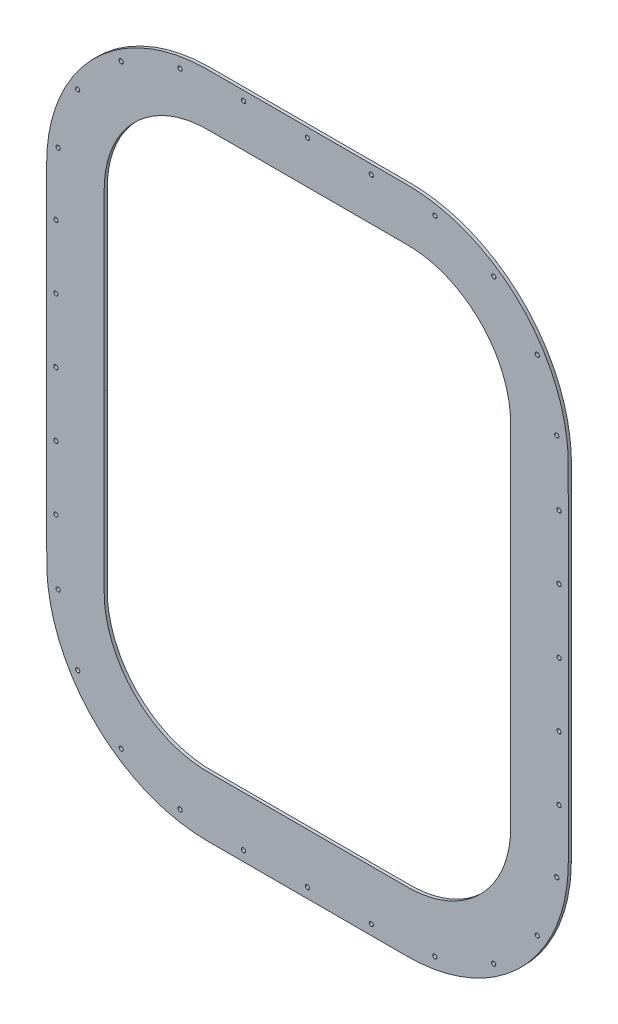
from build123d import *

# Parameters (mm, degrees)
EXTRUDE_1_DEPTH = 4


with BuildPart() as part:
    # Model → Бобышка-Вытянуть1 (new body)
    with BuildSketch(Plane.XY):
        with BuildLine():
            add(Edge.make_bspline(
                [(686.79903265, 219.435095571), (686.801471574, 233.710822805), (686.799796508, 247.986549765), (686.799693819, 276.538003981), (686.800054944, 290.813731085), (686.800062362, 333.640912407), (686.79998244, 362.192366622), (686.799968233, 447.846729266), (686.800032272, 504.949637696), (686.799998033, 590.619212881), (686.799984126, 619.185879641), (686.800004155, 654.894213078), (686.803094929, 662.03590296), (686.798415235, 670.962957183), (686.777172726, 672.748258396), (686.685899664, 676.317944766), (686.617565487, 678.101551055), (686.344461131, 683.450814472), (686.072136738, 687.00677774), (684.256643142, 704.768575572), (681.362249708, 718.793821863), (672.786503269, 746.043387423), (667.12629412, 759.199874441), (653.241191579, 784.166729827), (645.050169816, 795.916181646), (626.424351628, 817.579742508), (616.051023033, 827.425111673), (593.440710518, 844.892660865), (581.272176642, 852.454767545), (555.563225467, 865.000542833), (542.066845447, 869.951118157), (514.3075967, 877.00391814), (500.089153855, 879.096160255), (483.993146605, 879.789498154), (482.146292014, 879.843981489), (478.691016285, 879.904715907), (477.632260397, 879.905743494), (472.804663661, 879.905123625), (468.903336119, 879.905483704), (458.163406683, 879.905514761), (451.003453726, 879.905520494), (429.523594855, 879.905518157), (415.20368894, 879.905499555), (343.604159369, 879.905483646), (286.324535712, 879.905747584), (225.47219111, 879.905283517), (221.89946981, 879.905153046), (217.433569075, 879.905234528), (216.540398183, 879.908122082), (214.754026754, 879.896723484), (213.860933019, 879.886817803), (211.181750852, 879.837588571), (209.396765235, 879.781834933), (200.473365208, 879.388318468), (193.362393768, 878.70749377), (172.156128166, 875.572295263), (158.290723249, 872.041115037), (131.458468929, 862.195415115), (118.600361788, 855.921296787), (94.322258209, 840.841347264), (82.97329922, 832.074248392), (62.244802154, 812.400835304), (52.9194129, 801.552840549), (36.577247232, 778.110035589), (29.624529656, 765.609070045), (18.331446385, 739.359778286), (14.03388118, 725.707906682), (8.259345446, 697.722605973), (6.798204201, 683.447731688), (6.800000054, 669.159812492)],
                knots=[1370.97340501, 1370.97340501, 1370.97340501, 1370.97340501, 1413.74012173, 1413.74012173, 1456.50683845, 1456.50683845, 1542.04027189, 1542.04027189, 1713.10713877, 1713.10713877, 1798.686145398, 1798.686145398, 1820.080897055, 1820.080897055, 1825.429584969, 1825.429584969, 1830.778272883, 1830.778272883, 1841.475648712, 1841.475648712, 1884.265152026, 1884.265152026, 1927.054655339, 1927.054655339, 1969.844158653, 1969.844158653, 2012.633661967, 2012.633661967, 2055.423165281, 2055.423165281, 2098.311407557, 2098.311407557, 2141.199649833, 2141.199649833, 2146.560680117, 2146.560680117, 2151.921710402, 2151.921710402, 2162.643770971, 2162.643770971, 2184.087892109, 2184.087892109, 2226.976134385, 2226.976134385, 2398.529103488, 2398.529103488, 2409.229433669, 2409.229433669, 2411.904516214, 2411.904516214, 2414.579598759, 2414.579598759, 2419.92976385, 2419.92976385, 2441.330424212, 2441.330424212, 2484.131744935, 2484.131744935, 2526.933065659, 2526.933065659, 2569.734386383, 2569.734386383, 2612.535707106, 2612.535707106, 2655.33702783, 2655.33702783, 2698.138348553, 2698.138348553, 2740.939669277, 2740.939669277, 2740.939669277, 2740.939669277], degree=3))
            add(Edge.make_bspline(
                [(6.800000054, 669.159812492), (6.800000052, 554.953992939), (6.800000064, 440.748173386), (6.800000065, 297.972014993), (6.800002007, 269.401676152), (6.799999815, 237.260044957), (6.799976961, 233.688752602), (6.799965846, 226.546167892), (6.798811526, 222.974727472), (6.802551566, 212.261299053), (7.161670273, 205.163999326), (9.335707046, 183.846146673), (12.233294719, 169.790189422), (20.808315362, 142.535856727), (26.469921657, 129.371468925), (36.886789771, 110.644641399), (40.651222618, 104.616208217), (48.821585477, 92.896367332), (53.176222082, 87.27963982), (67.147740829, 71.028967324), (77.523248196, 61.182367628), (100.139222525, 43.714897653), (112.320449161, 36.147734993), (138.040848463, 23.604414434), (151.543512394, 18.655164261), (172.372718421, 13.368309255), (179.362263869, 11.971402257), (193.53635422, 9.888100577), (200.631941496, 9.2149444), (209.57822955, 8.827831841), (211.423025702, 8.77291108), (214.8870471, 8.711495234), (215.904356708, 8.710739001), (220.630646515, 8.711876811), (224.587674201, 8.711222269), (235.332483269, 8.711159611), (242.495689315, 8.711133699), (263.985307451, 8.71108877), (278.311719542, 8.711102561), (349.943779995, 8.711193276), (407.249428358, 8.711068856), (468.137306279, 8.711191166), (471.738896962, 8.71126918), (477.083036636, 8.711178142), (478.213059417, 8.708891428), (481.441211907, 8.756565881), (483.365339667, 8.806326807), (492.313637777, 9.164819699), (499.415687529, 9.816461833), (513.593463849, 11.85502666), (520.593513288, 13.23087233), (534.48754909, 16.712896814), (541.309582069, 18.798975661), (561.507615986, 26.12504965), (574.438657871, 32.38114517), (598.826725282, 47.423771888), (610.220134107, 56.175523364), (631.053585366, 75.845469596), (640.444817944, 86.724454426), (656.870507841, 110.19852736), (663.880519551, 122.76357344), (675.223995329, 149.072040629), (679.547566955, 162.782857938), (683.892752152, 183.825114761), (684.977886456, 190.868098881), (686.071368565, 201.555237786), (686.344546564, 205.12148439), (686.61831603, 210.486107497), (686.686774203, 212.274800581), (686.77810648, 215.854731703), (686.798726751, 217.644583058), (686.79903265, 219.435095571)],
                knots=[0, 0, 0, 0, 342.110543955, 342.110543955, 427.694747981, 427.694747981, 438.392773485, 438.392773485, 449.090798988, 449.090798988, 470.486849995, 470.486849995, 513.278952008, 513.278952008, 556.071054021, 556.071054021, 577.467105027, 577.467105027, 598.863156034, 598.863156034, 641.655258047, 641.655258047, 684.44736006, 684.44736006, 727.351485227, 727.351485227, 748.80354781, 748.80354781, 770.255610394, 770.255610394, 775.618626039, 775.618626039, 780.981641685, 780.981641685, 791.707672977, 791.707672977, 813.15973556, 813.15973556, 856.063860727, 856.063860727, 1027.680361394, 1027.680361394, 1038.408269007, 1038.408269007, 1043.772222814, 1043.772222814, 1049.13617662, 1049.13617662, 1070.591991846, 1070.591991846, 1092.047807072, 1092.047807072, 1113.503622298, 1113.503622298, 1156.41525275, 1156.41525275, 1199.326883202, 1199.326883202, 1242.238513654, 1242.238513654, 1285.150144106, 1285.150144106, 1328.061774558, 1328.061774558, 1349.517589784, 1349.517589784, 1360.245497397, 1360.245497397, 1365.609451204, 1365.609451204, 1370.97340501, 1370.97340501, 1370.97340501, 1370.97340501], degree=3))
        make_face()
        with BuildLine():
            add(Edge.make_bspline(
                [(611.800005283, 449.694859246), (611.800005277, 402.179111379), (611.799999115, 354.663363511), (611.800001907, 283.38974171), (611.800000229, 259.631867776), (611.800000023, 232.904259601), (611.800170703, 229.934525303), (611.799903097, 225.479924029), (611.800509814, 223.971079763), (611.799883027, 221.05385288), (611.787373905, 219.81352136), (611.574885277, 212.400970284), (611.015480159, 206.482944612), (608.172904292, 188.891071297), (604.734918929, 177.444848433), (594.960556039, 155.786030333), (588.633075829, 145.60389916), (577.327304833, 131.827477596), (573.266651017, 127.495319203), (564.58286839, 119.384918455), (559.959598453, 115.605154374), (550.282723746, 108.709280776), (545.216747116, 105.580797567), (534.716879579, 100.018566201), (529.296989473, 97.59032075), (512.58420655, 91.393000455), (500.919338067, 88.741274009), (486.126720279, 87.389018693), (483.121573922, 87.216298793), (478.735998706, 87.10603426), (477.566252414, 87.098990269), (474.647171685, 87.101024236), (473.137581148, 87.100219803), (465.710546617, 87.100911096), (459.768918745, 87.100409378), (441.944035511, 87.100199734), (430.060780013, 87.10035315), (394.411013532, 87.100352269), (370.644502544, 87.10035105), (323.140531461, 87.100352502), (299.403071366, 87.100354939), (263.796881223, 87.100353391), (251.928151176, 87.100348049), (234.125056104, 87.100332859), (228.190691082, 87.100339217), (220.772734804, 87.100550627), (219.289142411, 87.100743241), (217.063757254, 87.100628119), (216.321976681, 87.098433568), (214.838385532, 87.113368553), (214.096709431, 87.125318415), (210.388753912, 87.220293292), (207.43272874, 87.393187453), (192.657975435, 88.748394351), (181.013950603, 91.392577045), (164.320990377, 97.583186901), (158.878844895, 100.019327381), (148.390177121, 105.575229251), (143.308796145, 108.713987718), (133.645206533, 115.604715677), (129.036518062, 119.371915583), (120.360904055, 127.469085942), (116.332994012, 131.756714139), (108.794979798, 140.923192373), (105.32494235, 145.758553619), (99.055100746, 155.834436654), (96.260427839, 161.065119677), (91.370290537, 171.878155055), (89.279102239, 177.452066816), (85.849515986, 188.813024816), (84.514594917, 194.591303452), (82.604364943, 206.30365302), (82.03758274, 212.206938125), (81.838370663, 218.879141746), (81.822364977, 219.620575312), (81.802178326, 221.103820459), (81.800047994, 221.845433327), (81.799947388, 224.070429724), (81.800011971, 225.553764294), (81.800009116, 230.003762564), (81.800007456, 232.970428077), (81.799994447, 259.670417693), (81.799996624, 283.403741796), (81.800000579, 354.603714105), (81.799999469, 402.070362312), (81.800000048, 449.537010518)],
                knots=[1139.240406798, 1139.240406798, 1139.240406798, 1139.240406798, 1281.689862325, 1281.689862325, 1352.914590088, 1352.914590088, 1361.817681058, 1361.817681058, 1366.269226543, 1366.269226543, 1370.720772029, 1370.720772029, 1388.526953969, 1388.526953969, 1424.139317851, 1424.139317851, 1459.75433655, 1459.75433655, 1477.561845899, 1477.561845899, 1495.369355248, 1495.369355248, 1513.176864597, 1513.176864597, 1530.984373947, 1530.984373947, 1566.599392645, 1566.599392645, 1575.50314732, 1575.50314732, 1579.955024657, 1579.955024657, 1584.406901995, 1584.406901995, 1602.214411344, 1602.214411344, 1637.829430043, 1637.829430043, 1709.05946744, 1709.05946744, 1780.202437108, 1780.202437108, 1815.773921942, 1815.773921942, 1833.559664359, 1833.559664359, 1838.006099963, 1838.006099963, 1840.229317765, 1840.229317765, 1842.452535567, 1842.452535567, 1851.345406776, 1851.345406776, 1886.91689161, 1886.91689161, 1904.702634027, 1904.702634027, 1922.488376444, 1922.488376444, 1940.274118861, 1940.274118861, 1958.059861278, 1958.059861278, 1975.845603695, 1975.845603695, 1993.631346112, 1993.631346112, 2011.418034516, 2011.418034516, 2029.20472292, 2029.20472292, 2046.991411323, 2046.991411323, 2049.214747374, 2049.214747374, 2051.438083424, 2051.438083424, 2055.884755525, 2055.884755525, 2064.778099727, 2064.778099727, 2135.924853342, 2135.924853342, 2278.218360573, 2278.218360573, 2278.218360573, 2278.218360573], degree=3))
            add(Edge.make_bspline(
                [(81.800000048, 449.537010518), (81.799998785, 497.002370026), (81.800001167, 544.467729534), (81.799997592, 615.665768796), (81.799997058, 639.398448548), (81.800362278, 666.097713271), (81.800407939, 669.06429824), (81.800485002, 673.514175693), (81.800501065, 674.997469078), (81.800560648, 677.222406449), (81.801157238, 677.964012203), (81.820265454, 679.447251281), (81.83575947, 680.188682342), (82.029357789, 686.860971874), (82.590201116, 692.764749966), (84.488517021, 704.479029104), (85.821139951, 710.271754513), (89.237748859, 721.636841588), (91.320276377, 727.206038981), (96.198321013, 738.026327452), (98.96308525, 743.220527408), (105.218610387, 753.308426472), (108.681043036, 758.149367825), (116.206974434, 767.330184758), (120.228832402, 771.626293626), (128.89381606, 779.739319116), (133.482364745, 783.501728421), (143.136741141, 790.409933856), (148.211086806, 793.55644969), (158.694195498, 799.130954686), (164.118794039, 801.57038056), (180.806480075, 807.790836833), (192.450224472, 810.455186907), (207.227031205, 811.833627916), (210.183867182, 812.011170585), (213.892742395, 812.111522889), (214.634636887, 812.125505388), (216.1187001, 812.141359378), (216.860743064, 812.141261618), (219.086899446, 812.141168295), (220.571010067, 812.141204902), (227.99154747, 812.141149312), (233.927977393, 812.141114759), (251.73726716, 812.141035528), (263.610127005, 812.141015276), (299.22870654, 812.14100957), (322.974426229, 812.141079166), (370.522438479, 812.141137722), (394.324731038, 812.141126556), (430.028169876, 812.140854265), (441.929316155, 812.140720911), (459.781035573, 812.140432641), (465.731608712, 812.140321844), (473.169825135, 812.140162429), (474.734694019, 812.140081), (477.531850094, 812.140146793), (478.455747811, 812.139258911), (481.263302076, 812.075068614), (482.822052654, 812.015934607), (485.789185774, 811.850691583), (487.27122191, 811.743494089), (500.60682663, 810.558675657), (512.296168063, 807.927313421), (534.629714891, 799.697086265), (545.231858105, 794.10253406), (559.783079178, 783.766119143), (564.404388885, 780.000588819), (573.112838058, 771.890669949), (577.186691305, 767.558024468), (588.52684436, 753.775303667), (594.866888639, 743.599381232), (604.669802358, 721.947264944), (608.123101055, 710.497161975), (610.988640106, 692.928933974), (611.557453799, 687.025957265), (611.760022842, 680.353985696), (611.776475836, 679.612576632), (611.797153051, 678.129363676), (611.79989124, 677.387690385), (611.799862243, 675.162679713), (611.799985121, 673.679338324), (611.800057299, 669.22931556), (611.800040816, 666.262633718), (611.799852901, 639.562497139), (611.800017442, 615.829042403), (611.799987287, 544.628678193), (611.800005288, 497.16176872), (611.800005283, 449.694859246)],
                knots=[0, 0, 0, 0, 142.305933701, 142.305933701, 213.458900552, 213.458900552, 222.353021408, 222.353021408, 226.800081836, 226.800081836, 229.023612051, 229.023612051, 231.247142265, 231.247142265, 249.035383977, 249.035383977, 266.82362569, 266.82362569, 284.611867403, 284.611867403, 302.403874966, 302.403874966, 320.19588253, 320.19588253, 337.987890093, 337.987890093, 355.779897657, 355.779897657, 373.57190522, 373.57190522, 391.363912784, 391.363912784, 426.947927911, 426.947927911, 435.843931693, 435.843931693, 438.067932638, 438.067932638, 440.291933584, 440.291933584, 444.739935475, 444.739935475, 462.531943038, 462.531943038, 498.115958165, 498.115958165, 569.283988419, 569.283988419, 640.621572587, 640.621572587, 676.290364671, 676.290364671, 694.124760713, 694.124760713, 698.583359723, 698.583359723, 703.041958734, 703.041958734, 707.500557744, 707.500557744, 711.959156755, 711.959156755, 747.627948839, 747.627948839, 783.296740923, 783.296740923, 801.131136965, 801.131136965, 818.965533007, 818.965533007, 854.63432509, 854.63432509, 890.210085304, 890.210085304, 907.997965411, 907.997965411, 910.221450424, 910.221450424, 912.444935437, 912.444935437, 916.891905464, 916.891905464, 925.785845517, 925.785845517, 996.937365944, 996.937365944, 1139.240406798, 1139.240406798, 1139.240406798, 1139.240406798], degree=3))
        make_face(mode=Mode.SUBTRACT)
        with BuildLine():
            add(Edge.make_bspline(
                [(21.772908272, 192.753288084), (21.410946417, 192.750959572), (21.051088244, 192.829814684), (20.385092994, 193.102070556), (20.083792184, 193.306515548), (19.571108214, 193.812596302), (19.372170111, 194.122845987), (19.093986471, 194.785995874), (19.02508282, 195.144025442), (19.020855555, 195.864397904), (19.100446554, 196.224277051), (19.372817207, 196.889693841), (19.576494123, 197.191908096), (20.083046788, 197.704676561), (20.392962409, 197.903279819), (21.056735142, 198.181661859), (21.414165745, 198.249949138), (21.772969053, 198.252236859)],
                knots=[-8.65534924, -8.65534924, -8.65534924, -8.65534924, -7.587710129, -7.587710129, -6.520071019, -6.520071019, -5.443135309, -5.443135309, -4.366199599, -4.366199599, -3.279574121, -3.279574121, -2.192948642, -2.192948642, -1.096474321, -1.096474321, 0, 0, 0, 0], degree=3))
            add(Edge.make_bspline(
                [(21.772969053, 198.252236859), (22.13178822, 198.249947909), (22.489291834, 198.181516959), (23.153031197, 197.903109896), (23.462901627, 197.704620207), (23.9696888, 197.191706506), (24.173826345, 196.89059479), (24.44655585, 196.224262166), (24.52502074, 195.865018897), (24.52091809, 195.144457476), (24.451942369, 194.786411738), (24.173948188, 194.123408409), (23.974988098, 193.812784253), (23.198521973, 193.046231876), (22.502384404, 192.757980828), (21.772908272, 192.753288084)],
                knots=[-17.268881701, -17.268881701, -17.268881701, -17.268881701, -16.182391651, -16.182391651, -15.0959016, -15.0959016, -14.01837559, -14.01837559, -12.94084958, -12.94084958, -11.873927206, -11.873927206, -10.807004832, -10.807004832, -8.65534924, -8.65534924, -8.65534924, -8.65534924], degree=3))
        make_face(mode=Mode.SUBTRACT)
        with BuildLine():
            add(Edge.make_bspline(
                [(18.800902487, 275.827549323), (18.438954409, 275.825221495), (18.079112752, 275.904063543), (17.413129997, 276.176280931), (17.111828576, 276.38070186), (16.350804825, 277.131835159), (16.046423425, 277.866055853), (16.053253323, 278.935091821), (16.122833298, 279.29299665), (16.400894335, 279.955623318), (16.599180336, 280.266950867), (17.378426473, 281.036056688), (18.067804104, 281.321406191), (18.800963197, 281.32608173)],
                knots=[-8.615955583, -8.615955583, -8.615955583, -8.615955583, -7.539826154, -7.539826154, -6.463696725, -6.463696725, -4.331196001, -4.331196001, -3.255510921, -3.255510921, -2.179825841, -2.179825841, 0, 0, 0, 0], degree=3))
            add(Edge.make_bspline(
                [(18.800963197, 281.32608173), (19.533778122, 281.321406191), (20.223778991, 281.035751791), (21.251064171, 280.021891756), (21.555427383, 279.287491026), (21.548709455, 278.218362218), (21.480166383, 277.860832113), (21.201802149, 277.197431338), (21.003173125, 276.887140443), (20.226469408, 276.120445482), (19.530344812, 275.832240649), (18.800902487, 275.827549323)],
                knots=[-17.268228053, -17.268228053, -17.268228053, -17.268228053, -15.069566155, -15.069566155, -12.937354896, -12.937354896, -11.861029493, -11.861029493, -10.78470409, -10.78470409, -8.615955583, -8.615955583, -8.615955583, -8.615955583], degree=3))
        make_face(mode=Mode.SUBTRACT)
        with BuildLine():
            add(Edge.make_bspline(
                [(18.800984782, 359.012992429), (18.439089261, 359.01066379), (18.079190986, 359.08949448), (17.413291799, 359.361665827), (17.111937906, 359.566043876), (16.35093024, 360.317155136), (16.046503443, 361.051179781), (16.053336369, 362.120285285), (16.122927356, 362.478123886), (16.401021484, 363.14077237), (16.599299892, 363.451981298), (17.378521169, 364.221021344), (18.067985659, 364.506306205), (18.801045295, 364.510980605)],
                knots=[-8.615610382, -8.615610382, -8.615610382, -8.615610382, -7.53957187, -7.53957187, -6.463533357, -6.463533357, -4.330995333, -4.330995333, -3.255301295, -3.255301295, -2.179607257, -2.179607257, 0, 0, 0, 0], degree=3))
            add(Edge.make_bspline(
                [(18.801045295, 364.510980605), (19.533746923, 364.506306181), (20.22386035, 364.220717274), (21.251107439, 363.206924713), (21.555511548, 362.472703043), (21.54879048, 361.403506104), (21.480240919, 361.046062681), (21.201835781, 360.382626906), (21.003208134, 360.072466829), (20.226572622, 359.305820942), (19.53028794, 359.017685174), (18.800984782, 359.012992429)],
                knots=[-17.267373452, -17.267373452, -17.267373452, -17.267373452, -15.068965637, -15.068965637, -12.936767002, -12.936767002, -11.860421902, -11.860421902, -10.784076802, -10.784076802, -8.615610382, -8.615610382, -8.615610382, -8.615610382], degree=3))
        make_face(mode=Mode.SUBTRACT)
        with BuildLine():
            add(Edge.make_bspline(
                [(18.80106671, 442.182469994), (18.068241777, 442.187158157), (17.378451393, 442.472626059), (16.351034847, 443.486389837), (16.046587505, 444.22050758), (16.053417356, 445.289456311), (16.123011145, 445.647328197), (16.401112408, 446.309860343), (16.599423079, 446.621139327), (17.378715289, 447.390056148), (18.068044782, 447.675287119), (18.801127268, 447.679960738)],
                knots=[-8.578339951, -8.578339951, -8.578339951, -8.578339951, -6.400679697, -6.400679697, -4.288939182, -4.288939182, -3.223754785, -3.223754785, -2.158570387, -2.158570387, 0, 0, 0, 0], degree=3))
            add(Edge.make_bspline(
                [(18.801127268, 447.679960738), (19.533862025, 447.675287122), (20.223821414, 447.389751478), (21.251161318, 446.376140237), (21.555592796, 445.641837064), (21.548872896, 444.572796578), (21.480317031, 444.215299111), (21.201908543, 443.551989945), (21.003257922, 443.241754994), (20.490575301, 442.735827534), (20.188175343, 442.531981302), (19.52318645, 442.260168795), (19.162707649, 442.180156438), (18.80106671, 442.182469994)],
                knots=[-17.266592608, -17.266592608, -17.266592608, -17.266592608, -15.049110735, -15.049110735, -12.898663332, -12.898663332, -11.813152711, -11.813152711, -10.72764209, -10.72764209, -9.652991021, -9.652991021, -8.578339951, -8.578339951, -8.578339951, -8.578339951], degree=3))
        make_face(mode=Mode.SUBTRACT)
        with BuildLine():
            add(Edge.make_bspline(
                [(18.801148529, 525.339550563), (18.439249586, 525.337224124), (18.079468076, 525.41602067), (17.413529611, 525.688095259), (17.112240779, 525.89242272), (16.351152601, 526.643269155), (16.046668243, 527.377349514), (16.053499624, 528.446240815), (16.12309843, 528.804097293), (16.401222038, 529.466575558), (16.599546147, 529.777834491), (17.378865272, 530.546650073), (18.068164556, 530.831818179), (18.801209055, 530.836490791)],
                knots=[-8.614653091, -8.614653091, -8.614653091, -8.614653091, -7.538656485, -7.538656485, -6.462659879, -6.462659879, -4.330465269, -4.330465269, -3.254972908, -3.254972908, -2.179480548, -2.179480548, 0, 0, 0, 0], degree=3))
            add(Edge.make_bspline(
                [(18.801209055, 530.836490791), (19.533908163, 530.831818178), (20.223833005, 530.546345311), (21.251208631, 529.532871446), (21.555675213, 528.798607996), (21.54895439, 527.729625012), (21.480391359, 527.372138503), (21.201962053, 526.708885952), (21.003298173, 526.398669711), (20.226525716, 525.63226535), (19.530472871, 525.344238966), (18.801148529, 525.339550563)],
                knots=[-17.265728293, -17.265728293, -17.265728293, -17.265728293, -15.067308212, -15.067308212, -12.935376301, -12.935376301, -11.859226922, -11.859226922, -10.783077543, -10.783077543, -8.614653091, -8.614653091, -8.614653091, -8.614653091], degree=3))
        make_face(mode=Mode.SUBTRACT)
        with BuildLine():
            add(Edge.make_bspline(
                [(18.801229949, 608.500337328), (18.068346126, 608.505027035), (17.378512986, 608.790589555), (16.351144207, 609.804555593), (16.046751378, 610.538742694), (16.053580437, 611.607769865), (16.123164894, 611.965666294), (16.401233695, 612.628277073), (16.599523896, 612.939590289), (17.378777954, 613.708660562), (18.068147926, 613.993984878), (18.801290587, 613.998660001)],
                knots=[-8.579118772, -8.579118772, -8.579118772, -8.579118772, -6.401296726, -6.401296726, -4.289369962, -4.289369962, -3.224072842, -3.224072842, -2.158775721, -2.158775721, 0, 0, 0, 0], degree=3))
            add(Edge.make_bspline(
                [(18.801290587, 613.998660001), (19.534086154, 613.993984882), (20.224084817, 613.708355817), (21.251376756, 612.694541105), (21.555755097, 611.960167047), (21.549036688, 610.891049329), (21.480491576, 610.533530116), (21.202116847, 609.870142223), (21.003484422, 609.559869804), (20.490826291, 609.053841783), (20.188414655, 608.849944997), (19.523404111, 608.578059241), (19.162895714, 608.498023038), (18.801229949, 608.500337328)],
                knots=[-17.267898642, -17.267898642, -17.267898642, -17.267898642, -15.050310993, -15.050310993, -12.899740491, -12.899740491, -11.814147959, -11.814147959, -10.728555427, -10.728555427, -9.653837099, -9.653837099, -8.579118772, -8.579118772, -8.579118772, -8.579118772], degree=3))
        make_face(mode=Mode.SUBTRACT)
        with BuildLine():
            add(Edge.make_bspline(
                [(47.206068172, 769.936642918), (46.47324489, 769.941331118), (45.783449435, 770.226801637), (44.756034812, 771.240568315), (44.451588924, 771.974683948), (44.458418817, 773.043635554), (44.52801289, 773.40150767), (44.806113711, 774.06404099), (45.004423874, 774.375320239), (45.783716285, 775.144240364), (46.473044257, 775.429471381), (47.206128718, 775.434145)],
                knots=[-8.578351209, -8.578351209, -8.578351209, -8.578351209, -6.400695359, -6.400695359, -4.28894839, -4.28894839, -3.223762523, -3.223762523, -2.158576657, -2.158576657, 0, 0, 0, 0], degree=3))
            add(Edge.make_bspline(
                [(47.206128718, 775.434145), (47.938865463, 775.429471385), (48.628823306, 775.14393569), (49.656162692, 774.13032089), (49.960594195, 773.396015897), (49.953874366, 772.326974428), (49.885318967, 771.969477364), (49.606910783, 771.306166218), (49.408260366, 770.995931836), (48.895578498, 770.490002715), (48.59317707, 770.286155913), (47.928189056, 770.014342614), (47.567708935, 769.934329339), (47.206068172, 769.936642918)],
                knots=[-17.26661035, -17.26661035, -17.26661035, -17.26661035, -15.049123839, -15.049123839, -12.898677564, -12.898677564, -11.813165179, -11.813165179, -10.727652793, -10.727652793, -9.653002001, -9.653002001, -8.578351209, -8.578351209, -8.578351209, -8.578351209], degree=3))
        make_face(mode=Mode.SUBTRACT)
        with BuildLine():
            add(Edge.make_bspline(
                [(21.746480016, 691.508399598), (21.384479912, 691.51106746), (21.025954975, 691.594588793), (20.363556515, 691.875922781), (20.065227915, 692.08420453), (19.314228537, 692.845703165), (19.020034915, 693.583707367), (19.041218726, 694.652557958), (19.1157855, 695.0096175), (19.402753536, 695.668233583), (19.605340268, 695.976871858), (20.394925431, 696.735151385), (21.088076983, 697.011056805), (21.821185824, 697.005780089)],
                knots=[-8.617300268, -8.617300268, -8.617300268, -8.617300268, -7.540794865, -7.540794865, -6.464289462, -6.464289462, -4.331359274, -4.331359274, -3.255757863, -3.255757863, -2.180156452, -2.180156452, 0, 0, 0, 0], degree=3))
            add(Edge.make_bspline(
                [(21.821185824, 697.005780089), (22.553828124, 696.991164917), (23.239854367, 696.6962489), (24.253324084, 695.668691301), (24.547724256, 694.930280811), (24.526483434, 693.861132296), (24.453082404, 693.505004385), (24.165635877, 692.84502596), (23.962858698, 692.538044723), (23.17645231, 691.782001346), (22.475196678, 691.503029115), (21.746480016, 691.508399598)],
                knots=[-17.267222186, -17.267222186, -17.267222186, -17.267222186, -15.069293693, -15.069293693, -12.937812729, -12.937812729, -11.861074728, -11.861074728, -10.784336727, -10.784336727, -8.617300268, -8.617300268, -8.617300268, -8.617300268], degree=3))
        make_face(mode=Mode.SUBTRACT)
        with BuildLine():
            add(Edge.make_bspline(
                [(103.920974293, 830.078259722), (103.202074578, 830.076239459), (102.483878344, 830.376484123), (101.465392375, 831.396227199), (101.172167859, 832.102541726), (101.170483349, 833.544877914), (101.468839382, 834.262996624), (102.494826889, 835.287449961), (103.191954106, 835.571159999), (103.921081054, 835.575807986)],
                knots=[-8.656254247, -8.656254247, -8.656254247, -8.656254247, -6.507829177, -6.507829177, -4.341708345, -4.341708345, -2.190884031, -2.190884031, 0, 0, 0, 0], degree=3))
            add(Edge.make_bspline(
                [(103.921081054, 835.575807986), (104.28154919, 835.57350901), (104.638213373, 835.504107724), (105.300887726, 835.228480738), (105.611632661, 835.024598614), (106.376074486, 834.261939624), (106.67013883, 833.549380687), (106.670840504, 832.106784515), (106.376077965, 831.393043867), (105.354574692, 830.373464068), (104.642341514, 830.08028692), (103.920974293, 830.078259722)],
                knots=[-17.266109869, -17.266109869, -17.266109869, -17.266109869, -16.186210563, -16.186210563, -15.120122678, -15.120122678, -12.964168879, -12.964168879, -10.812053437, -10.812053437, -8.656254247, -8.656254247, -8.656254247, -8.656254247], degree=3))
        make_face(mode=Mode.SUBTRACT)
        with BuildLine():
            add(Edge.make_bspline(
                [(180.631480697, 860.322793171), (179.912298811, 860.323378524), (179.196167589, 860.619226222), (178.176105917, 861.640051753), (177.881656972, 862.347570387), (177.881523036, 863.791618726), (178.179258224, 864.506990245), (178.942548444, 865.269891789), (179.241505442, 865.467607325), (179.917873418, 865.748844345), (180.258207562, 865.817807124), (180.631527238, 865.820186827)],
                knots=[-8.652906834, -8.652906834, -8.652906834, -8.652906834, -6.502807136, -6.502807136, -4.341051409, -4.341051409, -2.191211969, -2.191211969, -1.116837254, -1.116837254, 0, 0, 0, 0], degree=3))
            add(Edge.make_bspline(
                [(180.631527238, 865.820186827), (180.991775975, 865.817889355), (181.348448034, 865.748592643), (182.01156021, 865.47257302), (182.321861164, 865.269547327), (183.086268666, 864.505904756), (183.380672929, 863.793845245), (183.381571789, 862.352813345), (183.086406675, 861.637017126), (182.324469238, 860.877271595), (182.015058391, 860.672620953), (181.357618853, 860.400646144), (180.988011513, 860.322502984), (180.631480697, 860.322793171)],
                knots=[-17.265859486, -17.265859486, -17.265859486, -17.265859486, -16.181230164, -16.181230164, -15.107711102, -15.107711102, -12.942774585, -12.942774585, -10.786622032, -10.786622032, -9.718807987, -9.718807987, -8.652906834, -8.652906834, -8.652906834, -8.652906834], degree=3))
        make_face(mode=Mode.SUBTRACT)
        with BuildLine():
            add(Edge.make_bspline(
                [(263.541166263, 865.109052599), (262.819895019, 865.107219711), (262.106285192, 865.404201785), (261.334086119, 866.175267301), (261.144818259, 866.462682661), (260.859969298, 867.147885985), (260.790772042, 867.48615658), (260.790072265, 868.576961676), (261.087465091, 869.293285637), (261.85662175, 870.061589868), (262.167446766, 870.26476794), (262.845163614, 870.539052566), (263.177485268, 870.603604507), (263.540072697, 870.605915781)],
                knots=[-8.669528448, -8.669528448, -8.669528448, -8.669528448, -6.527716108, -6.527716108, -5.424882946, -5.424882946, -4.317513654, -4.317513654, -2.179199646, -2.179199646, -1.081624104, -1.081624104, 0, 0, 0, 0], degree=3))
            add(Edge.make_bspline(
                [(263.540072697, 870.605915781), (263.913953022, 870.603531391), (264.254859083, 870.535344633), (264.93910773, 870.249213947), (265.224169362, 870.060193655), (265.99769328, 869.290526146), (266.288037034, 868.578260341), (266.291607853, 867.136475355), (265.993519915, 866.422072149), (264.97528856, 865.405994373), (264.259220214, 865.110877311), (263.541166263, 865.109052599)],
                knots=[-17.265820113, -17.265820113, -17.265820113, -17.265820113, -16.159648422, -16.159648422, -15.073432332, -15.073432332, -12.936863001, -12.936863001, -10.801787046, -10.801787046, -8.669528448, -8.669528448, -8.669528448, -8.669528448], degree=3))
        make_face(mode=Mode.SUBTRACT)
        with BuildLine():
            add(Edge.make_bspline(
                [(346.812074178, 870.599800175), (347.533349989, 870.596574111), (348.245044277, 870.298891566), (349.259360051, 869.275857605), (349.55397539, 868.558979053), (349.546281867, 867.12501191), (349.245504843, 866.402604797), (348.216714805, 865.386577799), (347.516672372, 865.104588765), (346.7883093, 865.103045197)],
                knots=[-8.578875736, -8.578875736, -8.578875736, -8.578875736, -6.431907697, -6.431907697, -4.292209888, -4.292209888, -2.168449668, -2.168449668, 0, 0, 0, 0], degree=3))
            add(Edge.make_bspline(
                [(346.7883093, 865.103045197), (346.427534607, 865.106879087), (346.073911602, 865.176765462), (345.406313724, 865.45906561), (345.104059939, 865.656287544), (344.588099838, 866.179432636), (344.398243669, 866.466154186), (344.121056438, 867.144980505), (344.048098679, 867.498478643), (344.055022627, 868.585108431), (344.348528013, 869.294014307), (345.376866055, 870.309265545), (346.090446919, 870.60302781), (346.812074178, 870.599800175)],
                knots=[-17.265820476, -17.265820476, -17.265820476, -17.265820476, -16.176817626, -16.176817626, -15.083293708, -15.083293708, -13.973745624, -13.973745624, -12.885723017, -12.885723017, -10.726889903, -10.726889903, -8.578875736, -8.578875736, -8.578875736, -8.578875736], degree=3))
        make_face(mode=Mode.SUBTRACT)
        with BuildLine():
            add(Edge.make_bspline(
                [(430.059030745, 870.606326085), (430.777377522, 870.607349871), (431.496365384, 870.308597666), (432.516840028, 869.287388134), (432.8086638, 868.584472846), (432.81017876, 867.140515806), (432.512271615, 866.421006451), (431.48890472, 865.398530071), (430.785608087, 865.113538321), (430.059927272, 865.108917063)],
                knots=[-8.634778682, -8.634778682, -8.634778682, -8.634778682, -6.489992021, -6.489992021, -4.321533793, -4.321533793, -2.176712586, -2.176712586, 0, 0, 0, 0], degree=3))
            add(Edge.make_bspline(
                [(430.059927272, 865.108917063), (429.692773929, 865.111256267), (429.356995561, 865.177563588), (428.681746157, 865.454051341), (428.371516374, 865.657587721), (427.604796337, 866.424138294), (427.310615674, 867.136289475), (427.309821432, 868.577659167), (427.604905129, 869.29186979), (428.623618103, 870.308445067), (429.340694729, 870.605302314), (430.059030745, 870.606326085)],
                knots=[-17.26582059, -17.26582059, -17.26582059, -17.26582059, -16.167502022, -16.167502022, -15.084346429, -15.084346429, -12.931085632, -12.931085632, -10.779533211, -10.779533211, -8.634778682, -8.634778682, -8.634778682, -8.634778682], degree=3))
        make_face(mode=Mode.SUBTRACT)
        with BuildLine():
            add(Edge.make_bspline(
                [(512.968495399, 865.820374082), (513.694807048, 865.819502178), (514.398907647, 865.527072322), (515.424001347, 864.504089171), (515.718314874, 863.794797969), (515.718297481, 862.35673165), (515.421205537, 861.635622793), (514.398686422, 860.614335186), (513.694610816, 860.327787231), (512.968472732, 860.323163027)],
                knots=[-8.620815463, -8.620815463, -8.620815463, -8.620815463, -6.456516653, -6.456516653, -4.303943577, -4.303943577, -2.170065328, -2.170065328, 0, 0, 0, 0], degree=3))
            add(Edge.make_bspline(
                [(512.968472732, 860.323163027), (512.598902545, 860.325517646), (512.261256987, 860.39134356), (511.583377111, 860.673564842), (511.282206101, 860.869543973), (510.513582883, 861.640868857), (510.218313667, 862.347218977), (510.218897909, 863.79044089), (510.514489311, 864.507341504), (511.530007352, 865.5217366), (512.251623631, 865.821234654), (512.968495399, 865.820374082)],
                knots=[-17.265859963, -17.265859963, -17.265859963, -17.265859963, -16.155554109, -16.155554109, -15.063783596, -15.063783596, -12.900651808, -12.900651808, -10.756984859, -10.756984859, -8.620815463, -8.620815463, -8.620815463, -8.620815463], degree=3))
        make_face(mode=Mode.SUBTRACT)
        with BuildLine():
            add(Edge.make_bspline(
                [(589.678979501, 835.575807959), (590.411788965, 835.571109642), (591.101549231, 835.285706111), (592.128990357, 834.271995966), (592.433460082, 833.53791495), (592.426628121, 832.468983509), (592.357030812, 832.111127156), (592.078914523, 831.448613843), (591.880598966, 831.137362277), (591.10131115, 830.368505405), (590.411960133, 830.083293068), (589.67891892, 830.078624689)],
                knots=[-8.578041063, -8.578041063, -8.578041063, -8.578041063, -6.400399631, -6.400399631, -4.288730633, -4.288730633, -3.223581328, -3.223581328, -2.158432024, -2.158432024, 0, 0, 0, 0], degree=3))
            add(Edge.make_bspline(
                [(589.67891892, 830.078624689), (588.94622575, 830.083293065), (588.256244246, 830.368810051), (587.228904363, 831.382348501), (586.924454184, 832.116602614), (586.931172867, 833.185631353), (586.999733336, 833.543113351), (587.278154946, 834.206401875), (587.476810891, 834.516613619), (587.989494627, 835.022503352), (588.291892858, 835.226329388), (588.956853024, 835.498113022), (589.317356719, 835.578126459), (589.678979501, 835.575807959)],
                knots=[-17.266110344, -17.266110344, -17.266110344, -17.266110344, -15.048704717, -15.048704717, -12.89825933, -12.89825933, -11.812760706, -11.812760706, -10.727262081, -10.727262081, -9.652651572, -9.652651572, -8.578041063, -8.578041063, -8.578041063, -8.578041063], degree=3))
        make_face(mode=Mode.SUBTRACT)
        with BuildLine():
            add(Edge.make_bspline(
                [(646.394000376, 775.434509954), (647.112997225, 775.436523859), (647.830633954, 775.136494451), (648.850196982, 774.117562259), (649.143495534, 773.409498056), (649.142900463, 771.965630128), (648.847419699, 771.251460145), (647.824087102, 770.226309204), (647.118868203, 769.941260432), (646.393871261, 769.93664289)],
                knots=[-8.654512429, -8.654512429, -8.654512429, -8.654512429, -6.505321227, -6.505321227, -4.337640305, -4.337640305, -2.181262587, -2.181262587, 0, 0, 0, 0], degree=3))
            add(Edge.make_bspline(
                [(646.393871261, 769.93664289), (646.033388997, 769.938939908), (645.676704307, 770.008358846), (645.014019976, 770.284019267), (644.703284485, 770.487914925), (643.938853085, 771.250633762), (643.644810674, 771.963222549), (643.644114251, 773.405856166), (643.938862645, 774.119630572), (644.960360951, 775.139284634), (645.672601133, 775.43248932), (646.394000376, 775.434509954)],
                knots=[-17.266610819, -17.266610819, -17.266610819, -17.266610819, -16.186429682, -16.186429682, -15.120071518, -15.120071518, -12.963551961, -12.963551961, -10.810884751, -10.810884751, -8.654512429, -8.654512429, -8.654512429, -8.654512429], degree=3))
        make_face(mode=Mode.SUBTRACT)
        with BuildLine():
            add(Edge.make_bspline(
                [(671.778875214, 697.005777013), (672.140805191, 697.01293798), (672.50148267, 696.939164564), (673.17125519, 696.675921072), (673.475141282, 696.475799889), (673.994844031, 695.976685586), (674.197882019, 695.669325365), (674.485208887, 695.009953852), (674.558828007, 694.653110067), (674.57977634, 693.587237066), (674.283548895, 692.843431893), (673.271856277, 691.817629664), (672.586442542, 691.523009759), (671.853459241, 691.50839456)],
                knots=[-8.652599554, -8.652599554, -8.652599554, -8.652599554, -7.580202074, -7.580202074, -6.507804594, -6.507804594, -5.426130915, -5.426130915, -4.344457236, -4.344457236, -2.210458099, -2.210458099, 0, 0, 0, 0], degree=3))
            add(Edge.make_bspline(
                [(671.853459241, 691.50839456), (671.120704701, 691.50312748), (670.426908397, 691.779326162), (669.385614952, 692.779294041), (669.071872807, 693.508879508), (669.063636471, 694.578357328), (669.12763895, 694.936708391), (669.396824113, 695.603959709), (669.591412305, 695.916513185), (670.356847394, 696.693498268), (671.050283979, 696.991361469), (671.778875214, 697.005777013)],
                knots=[-17.267222562, -17.267222562, -17.267222562, -17.267222562, -15.078908799, -15.078908799, -12.955428538, -12.955428538, -11.883420908, -11.883420908, -10.811413278, -10.811413278, -8.652599554, -8.652599554, -8.652599554, -8.652599554], degree=3))
        make_face(mode=Mode.SUBTRACT)
        with BuildLine():
            add(Edge.make_bspline(
                [(674.798770105, 613.998659972), (675.531670217, 613.993959576), (676.221470323, 613.708426115), (677.248854005, 612.694446411), (677.553249301, 611.960253147), (677.546419199, 610.891229111), (677.476835878, 610.533333054), (677.1987665, 609.870721648), (677.000475746, 609.559409362), (676.221231717, 608.790348181), (675.531841855, 608.505007759), (674.798709407, 608.5003373)],
                knots=[-8.579100452, -8.579100452, -8.579100452, -8.579100452, -6.401218281, -6.401218281, -4.28931059, -4.28931059, -3.224017943, -3.224017943, -2.158725295, -2.158725295, 0, 0, 0, 0], degree=3))
            add(Edge.make_bspline(
                [(674.798709407, 608.5003373), (674.065924094, 608.505007755), (673.375905467, 608.790652929), (672.348621627, 609.804460771), (672.044245575, 610.538828973), (672.050962952, 611.607949888), (672.119508973, 611.96546914), (672.397883296, 612.628856789), (672.596515188, 612.939129803), (673.109168984, 613.445153045), (673.411572459, 613.649047365), (674.076569764, 613.920932868), (674.437109014, 614.000979457), (674.798770105, 613.998659972)],
                knots=[-17.267899094, -17.267899094, -17.267899094, -17.267899094, -15.050330416, -15.050330416, -12.899728541, -12.899728541, -11.814124719, -11.814124719, -10.728520896, -10.728520896, -9.653810674, -9.653810674, -8.579100452, -8.579100452, -8.579100452, -8.579100452], degree=3))
        make_face(mode=Mode.SUBTRACT)
        with BuildLine():
            add(Edge.make_bspline(
                [(674.798945337, 530.836544729), (675.521688324, 530.836009059), (676.230329338, 530.54233659), (677.251619187, 529.525144422), (677.549336334, 528.807335961), (677.547240997, 527.364529498), (677.254307429, 526.657208484), (676.228601216, 525.628813833), (675.523841201, 525.344167648), (674.798790945, 525.339550543)],
                knots=[-8.633628625, -8.633628625, -8.633628625, -8.633628625, -6.477942613, -6.477942613, -4.333020313, -4.333020313, -2.17352977, -2.17352977, 0, 0, 0, 0], degree=3))
            add(Edge.make_bspline(
                [(674.798790945, 525.339550543), (674.073662792, 525.344170322), (673.369439614, 525.629064286), (672.344231034, 526.656630262), (672.049947503, 527.363659129), (672.04789481, 528.808239149), (672.344684477, 529.522793649), (673.363365427, 530.538094196), (674.080580496, 530.837077153), (674.798945337, 530.836544729)],
                knots=[-17.265728736, -17.265728736, -17.265728736, -17.265728736, -15.089357128, -15.089357128, -12.929232148, -12.929232148, -10.776256181, -10.776256181, -8.633628625, -8.633628625, -8.633628625, -8.633628625], degree=3))
        make_face(mode=Mode.SUBTRACT)
        with BuildLine():
            add(Edge.make_bspline(
                [(674.798933336, 447.679960709), (675.531772396, 447.675261791), (676.221533655, 447.389821773), (677.248965203, 446.376045495), (677.553413637, 445.64192343), (677.546582068, 444.572976664), (677.476988669, 444.21510515), (677.198886787, 443.552572593), (677.000575813, 443.241294392), (676.221292749, 442.472384849), (675.531947015, 442.187138905), (674.798872737, 442.182469966)],
                knots=[-8.578321575, -8.578321575, -8.578321575, -8.578321575, -6.400608816, -6.400608816, -4.288884813, -4.288884813, -3.223705149, -3.223705149, -2.158525485, -2.158525485, 0, 0, 0, 0], degree=3))
            add(Edge.make_bspline(
                [(674.798872737, 442.182469966), (674.066146224, 442.187138901), (673.376170532, 442.472689521), (672.348838856, 443.486294998), (672.044408339, 444.220594048), (672.051126532, 445.289636569), (672.119682654, 445.64713424), (672.398090657, 446.310443261), (672.596740963, 446.620678713), (673.109419433, 447.126600941), (673.411811645, 447.330444164), (674.076786835, 447.602255938), (674.437297203, 447.682279498), (674.798933336, 447.679960709)],
                knots=[-17.266593023, -17.266593023, -17.266593023, -17.266593023, -15.049123824, -15.049123824, -12.89864854, -12.89864854, -11.813127041, -11.813127041, -10.727605543, -10.727605543, -9.652963559, -9.652963559, -8.578321575, -8.578321575, -8.578321575, -8.578321575], degree=3))
        make_face(mode=Mode.SUBTRACT)
        with BuildLine():
            add(Edge.make_bspline(
                [(674.799015261, 364.510980524), (675.160909576, 364.513310596), (675.520816145, 364.434478487), (676.186713002, 364.162309007), (676.488064696, 363.957932249), (677.249072378, 363.206824683), (677.553498951, 362.472796387), (677.546662432, 361.403692179), (677.477071036, 361.045854061), (677.198975962, 360.383205461), (677.000697397, 360.071997205), (676.221485885, 359.302962979), (675.532007249, 359.017662124), (674.798954715, 359.012992348)],
                knots=[-8.615612919, -8.615612919, -8.615612919, -8.615612919, -7.539573752, -7.539573752, -6.463534586, -6.463534586, -4.330988749, -4.330988749, -3.25528809, -3.25528809, -2.179587431, -2.179587431, 0, 0, 0, 0], degree=3))
            add(Edge.make_bspline(
                [(674.798954715, 359.012992348), (674.066260186, 359.017662148), (673.376132622, 359.303267053), (672.348895284, 360.317055005), (672.044490835, 361.051273234), (672.051208327, 362.120471492), (672.119757382, 362.477915301), (672.398161677, 363.141351162), (672.596789158, 363.451511672), (673.373432631, 364.218161633), (674.06970658, 364.50628484), (674.799015261, 364.510980524)],
                knots=[-17.267373962, -17.267373962, -17.267373962, -17.267373962, -15.068997578, -15.068997578, -12.936794452, -12.936794452, -11.860449376, -11.860449376, -10.7841043, -10.7841043, -8.615612919, -8.615612919, -8.615612919, -8.615612919], degree=3))
        make_face(mode=Mode.SUBTRACT)
        with BuildLine():
            add(Edge.make_bspline(
                [(674.799097554, 281.326081711), (675.16104172, 281.328413492), (675.520907867, 281.24956281), (676.18687957, 280.977345897), (676.48817563, 280.772927157), (677.249195213, 280.021798438), (677.553577324, 279.287575771), (677.546746317, 278.218540886), (677.477166608, 277.860635999), (677.199105274, 277.19800952), (677.000818915, 276.886681847), (676.22158015, 276.117582825), (675.532189463, 275.832220132), (674.799036817, 275.827549304)],
                knots=[-8.615963368, -8.615963368, -8.615963368, -8.615963368, -7.539840367, -7.539840367, -6.463717366, -6.463717366, -4.331201442, -4.331201442, -3.255507782, -3.255507782, -2.179814122, -2.179814122, 0, 0, 0, 0], degree=3))
            add(Edge.make_bspline(
                [(674.799036817, 275.827549304), (674.066228363, 275.832220133), (673.376214397, 276.117887722), (672.348935958, 277.131741766), (672.04457336, 277.866140639), (672.051290188, 278.93527059), (672.119833416, 279.292800441), (672.398197402, 279.956201572), (672.596826154, 280.266492292), (673.373540899, 281.033197686), (674.069645781, 281.321382307), (674.799097554, 281.326081711)],
                knots=[-17.268228449, -17.268228449, -17.268228449, -17.268228449, -15.069603381, -15.069603381, -12.937395992, -12.937395992, -11.861073219, -11.861073219, -10.784750446, -10.784750446, -8.615963368, -8.615963368, -8.615963368, -8.615963368], degree=3))
        make_face(mode=Mode.SUBTRACT)
        with BuildLine():
            add(Edge.make_bspline(
                [(671.827091461, 198.252236779), (672.537992894, 198.256813582), (673.271951552, 197.952633678), (674.023754898, 197.191683156), (674.227898107, 196.890661406), (674.500639853, 196.224363946), (674.579121, 195.864980641), (674.574943065, 195.144633186), (674.504907821, 194.78612691), (674.227189414, 194.12390057), (674.028625436, 193.812327841), (673.249619978, 193.043369919), (672.560219095, 192.757959649), (671.827030965, 192.75328805)],
                knots=[-8.654614005, -8.654614005, -8.654614005, -8.654614005, -6.50387717, -6.50387717, -5.417433861, -5.417433861, -4.330990552, -4.330990552, -3.255810623, -3.255810623, -2.180630694, -2.180630694, 0, 0, 0, 0], degree=3))
            add(Edge.make_bspline(
                [(671.827030965, 192.75328805), (671.09418816, 192.757959647), (670.4041619, 193.043674778), (669.625200491, 193.812547468), (669.426276767, 194.122856465), (669.14811097, 194.785966356), (669.079158331, 195.144011907), (669.074902155, 195.864624471), (669.153403638, 196.223903617), (669.426040715, 196.89021024), (669.630124411, 197.191414982), (670.136591423, 197.704217111), (670.447880097, 197.902412885), (671.11066887, 198.180368645), (671.468560645, 198.249928547), (671.827091461, 198.252236779)],
                knots=[-17.268882288, -17.268882288, -17.268882288, -17.268882288, -15.109299679, -15.109299679, -14.043164232, -14.043164232, -12.977028785, -12.977028785, -11.900508242, -11.900508242, -10.823987699, -10.823987699, -9.739300852, -9.739300852, -8.654614005, -8.654614005, -8.654614005, -8.654614005], degree=3))
        make_face(mode=Mode.SUBTRACT)
        with BuildLine():
            add(Edge.make_bspline(
                [(646.333885564, 119.739816651), (647.06695196, 119.735112667), (647.756796867, 119.449356936), (648.784094835, 118.434931138), (649.088362399, 117.700524083), (649.081535493, 116.631361563), (649.011976625, 116.273390506), (648.73398989, 115.610624448), (648.535737549, 115.299191726), (647.756556923, 114.529788619), (647.067125111, 114.244230845), (646.333824681, 114.239556831)],
                knots=[-8.5808917, -8.5808917, -8.5808917, -8.5808917, -6.402581837, -6.402581837, -4.290290567, -4.290290567, -3.224767671, -3.224767671, -2.159244776, -2.159244776, 0, 0, 0, 0], degree=3))
            add(Edge.make_bspline(
                [(646.333824681, 114.239556831), (645.600869789, 114.244230842), (644.910812243, 114.530093533), (643.883612276, 115.544349017), (643.579362392, 116.27893379), (643.586077534, 117.348192509), (643.654598613, 117.705786083), (643.932890908, 118.369329818), (644.131483408, 118.679721243), (644.644091806, 119.185964751), (644.946489193, 119.389973127), (645.611559998, 119.662033384), (645.972153267, 119.742137836), (646.333885564, 119.739816651)],
                knots=[-17.270940465, -17.270940465, -17.270940465, -17.270940465, -15.05306418, -15.05306418, -12.902212809, -12.902212809, -11.816441288, -11.816441288, -10.730669766, -10.730669766, -9.655780733, -9.655780733, -8.5808917, -8.5808917, -8.5808917, -8.5808917], degree=3))
        make_face(mode=Mode.SUBTRACT)
        with BuildLine():
            add(Edge.make_bspline(
                [(589.586260266, 59.591734129), (589.948270845, 59.59406749), (590.308187712, 59.515163439), (590.974228233, 59.242782826), (591.275519531, 59.0382553), (592.036475524, 58.286821191), (592.34073809, 57.552394683), (592.333909654, 56.483231358), (592.264353203, 56.125255774), (591.986369489, 55.462484282), (591.788118952, 55.151042894), (591.008940664, 54.381623565), (590.319509043, 54.09605474), (589.586199343, 54.091380539)],
                knots=[-8.617439327, -8.617439327, -8.617439327, -8.617439327, -7.541149715, -7.541149715, -6.464860103, -6.464860103, -4.33203103, -4.33203103, -3.256143051, -3.256143051, -2.180255072, -2.180255072, 0, 0, 0, 0], degree=3))
            add(Edge.make_bspline(
                [(589.586199343, 54.091380539), (588.853232351, 54.096054741), (588.163180268, 54.381928625), (587.135981113, 55.396202716), (586.831737621, 56.130804601), (586.838451915, 57.200063999), (586.906971862, 57.557664372), (587.185258523, 58.22121146), (587.383850224, 58.531614457), (588.160507461, 59.298639208), (588.856649974, 59.587031382), (589.586260266, 59.591734129)],
                knots=[-17.271087643, -17.271087643, -17.271087643, -17.271087643, -15.072130052, -15.072130052, -12.939640563, -12.939640563, -11.863138055, -11.863138055, -10.786635548, -10.786635548, -8.617439327, -8.617439327, -8.617439327, -8.617439327], degree=3))
        make_face(mode=Mode.SUBTRACT)
        with BuildLine():
            add(Edge.make_bspline(
                [(512.858872497, 29.396631571), (513.220881861, 29.398965018), (513.580811184, 29.320057964), (514.246846327, 29.047667539), (514.54814728, 28.843134495), (515.309094479, 28.091669924), (515.613350414, 27.357254146), (515.606521813, 26.288064648), (515.536965839, 25.930091457), (515.258984211, 25.267300469), (515.060739297, 24.955867482), (514.281574179, 24.186423131), (513.592120217, 23.900841863), (512.858811561, 23.896167482)],
                knots=[-8.617537058, -8.617537058, -8.617537058, -8.617537058, -7.541244616, -7.541244616, -6.464952175, -6.464952175, -4.332083021, -4.332083021, -3.256172725, -3.256172725, -2.180262429, -2.180262429, 0, 0, 0, 0], degree=3))
            add(Edge.make_bspline(
                [(512.858811561, 23.896167482), (512.12584556, 23.900841863), (511.435771235, 24.186728199), (510.408587164, 25.201037442), (510.104350132, 25.935632196), (510.111063999, 27.004916376), (510.179582624, 27.362510464), (510.457866171, 28.026078479), (510.656454272, 28.336474438), (511.43309641, 29.103524514), (512.129265521, 29.391928657), (512.858872497, 29.396631571)],
                knots=[-17.271261158, -17.271261158, -17.271261158, -17.271261158, -15.072306828, -15.072306828, -12.939786405, -12.939786405, -11.8632614, -11.8632614, -10.786736395, -10.786736395, -8.617537058, -8.617537058, -8.617537058, -8.617537058], degree=3))
        make_face(mode=Mode.SUBTRACT)
        with BuildLine():
            add(Edge.make_bspline(
                [(430.060011401, 24.611114563), (430.422019795, 24.613448023), (430.781952655, 24.534540442), (431.447985427, 24.262148202), (431.749289499, 24.057614286), (432.510234317, 23.306142548), (432.814489251, 22.571732037), (432.807660743, 21.502535074), (432.738104741, 21.144563477), (432.460123056, 20.481767138), (432.261879741, 20.170338337), (431.482718513, 19.400888662), (430.793257031, 19.11530539), (430.059950461, 19.110630984)],
                knots=[-8.617555346, -8.617555346, -8.617555346, -8.617555346, -7.541263585, -7.541263585, -6.464971824, -6.464971824, -4.332092888, -4.332092888, -3.256176702, -3.256176702, -2.180260516, -2.180260516, 0, 0, 0, 0], degree=3))
            add(Edge.make_bspline(
                [(430.059950461, 19.110630984), (429.326986544, 19.11530539), (428.636904703, 19.401193732), (427.609724956, 20.415510789), (427.305488998, 21.150100901), (427.31220292, 22.219392229), (427.380721378, 22.576983666), (427.659004642, 23.2405571), (427.857591908, 23.550949812), (428.634229601, 24.318005297), (429.330406845, 24.606411623), (430.060011401, 24.611114563)],
                knots=[-17.271291765, -17.271291765, -17.271291765, -17.271291765, -15.072341779, -15.072341779, -12.939813087, -12.939813087, -11.86328251, -11.86328251, -10.786751933, -10.786751933, -8.617555346, -8.617555346, -8.617555346, -8.617555346], degree=3))
        make_face(mode=Mode.SUBTRACT)
        with BuildLine():
            add(Edge.make_bspline(
                [(346.800060952, 24.615509536), (347.162069347, 24.617842997), (347.522002204, 24.538935415), (348.188034978, 24.266543177), (348.489339046, 24.062009262), (349.250283867, 23.310537531), (349.554538801, 22.576127014), (349.547710294, 21.506930059), (349.478154291, 21.14895846), (349.200172606, 20.486162127), (349.00192929, 20.174733321), (348.222768058, 19.405283651), (347.533306583, 19.119700381), (346.80000001, 19.115025976)],
                knots=[-8.617555331, -8.617555331, -8.617555331, -8.617555331, -7.541263569, -7.541263569, -6.464971807, -6.464971807, -4.332092879, -4.332092879, -3.256176699, -3.256176699, -2.180260519, -2.180260519, 0, 0, 0, 0], degree=3))
            add(Edge.make_bspline(
                [(346.80000001, 19.115025976), (346.067036092, 19.119700381), (345.376954258, 19.405588722), (344.349774507, 20.419905771), (344.045538548, 21.154495889), (344.05225247, 22.223787209), (344.120770928, 22.581378649), (344.399054193, 23.244952078), (344.59764146, 23.555344792), (345.374279157, 24.322400273), (346.070456393, 24.610806596), (346.800060952, 24.615509536)],
                knots=[-17.271291736, -17.271291736, -17.271291736, -17.271291736, -15.072341747, -15.072341747, -12.939813066, -12.939813066, -11.863282493, -11.863282493, -10.786751921, -10.786751921, -8.617555331, -8.617555331, -8.617555331, -8.617555331], degree=3))
        make_face(mode=Mode.SUBTRACT)
        with BuildLine():
            add(Edge.make_bspline(
                [(263.539988637, 19.110630998), (263.177975605, 19.108301442), (262.818068556, 19.187200156), (262.152023363, 19.459593119), (261.850715537, 19.664129637), (261.089766464, 20.415604086), (260.785511753, 21.150016665), (260.792338792, 22.219213506), (260.861894854, 22.577183932), (261.139876642, 23.239982355), (261.338119141, 23.551408409), (262.11728581, 24.320864982), (262.806739225, 24.60643545), (263.540049561, 24.611114576)],
                knots=[-8.617544768, -8.617544768, -8.617544768, -8.617544768, -7.541246405, -7.541246405, -6.464948041, -6.464948041, -4.33209066, -4.33209066, -3.256179898, -3.256179898, -2.180269136, -2.180269136, 0, 0, 0, 0], degree=3))
            add(Edge.make_bspline(
                [(263.540049561, 24.611114576), (264.273017256, 24.60643545), (264.963091008, 24.320559913), (265.990275896, 23.306235786), (266.294512002, 22.571647807), (266.287796617, 21.502356338), (266.219278037, 21.144763232), (265.94099471, 20.481191896), (265.742407081, 20.170797022), (264.96577826, 19.403751877), (264.269586548, 19.115325964), (263.539988637, 19.110630998)],
                knots=[-17.271291385, -17.271291385, -17.271291385, -17.271291385, -15.072308023, -15.072308023, -12.939768518, -12.939768518, -11.863237818, -11.863237818, -10.786707118, -10.786707118, -8.617544768, -8.617544768, -8.617544768, -8.617544768], degree=3))
        make_face(mode=Mode.SUBTRACT)
        with BuildLine():
            add(Edge.make_bspline(
                [(180.74112754, 23.896167497), (180.379113663, 23.893837955), (180.019209897, 23.972736199), (179.353162615, 24.24512744), (179.051857717, 24.4496631), (178.290906477, 25.201130737), (177.98665069, 25.935547962), (177.99347767, 27.004737474), (178.063033643, 27.36270969), (178.341015265, 28.025502477), (178.539259455, 28.336933152), (179.318430399, 29.1063842), (180.007875739, 29.391952488), (180.741188461, 29.396631587)],
                knots=[-8.617526301, -8.617526301, -8.617526301, -8.617526301, -7.541227273, -7.541227273, -6.464928246, -6.464928246, -4.332079808, -4.332079808, -3.256175494, -3.256175494, -2.180271181, -2.180271181, 0, 0, 0, 0], degree=3))
            add(Edge.make_bspline(
                [(180.741188461, 29.396631587), (181.474158542, 29.391952488), (182.16422422, 29.106079131), (183.191413861, 28.091763161), (183.495650968, 27.357169913), (183.488935485, 26.287885744), (183.420416696, 25.930290248), (183.14213301, 25.266724063), (182.943544574, 24.956326272), (182.166911705, 24.189286344), (181.470727573, 23.900862438), (180.74112754, 23.896167497)],
                knots=[-17.271260779, -17.271260779, -17.271260779, -17.271260779, -15.0722728, -15.0722728, -12.939742462, -12.939742462, -11.863216843, -11.863216843, -10.786691224, -10.786691224, -8.617526301, -8.617526301, -8.617526301, -8.617526301], degree=3))
        make_face(mode=Mode.SUBTRACT)
        with BuildLine():
            add(Edge.make_bspline(
                [(104.013739771, 54.091380556), (103.651725518, 54.089051106), (103.291832548, 54.167946302), (102.625781308, 54.440327394), (102.3244845, 54.644857148), (101.563524861, 55.396296016), (101.259262617, 56.130720333), (101.266090014, 57.199884548), (101.335646522, 57.557860365), (101.613629862, 58.220631588), (101.811880281, 58.532073517), (102.591065865, 59.301498867), (103.280484709, 59.587055221), (104.013800678, 59.591734146)],
                knots=[-8.617429607, -8.617429607, -8.617429607, -8.617429607, -7.541133346, -7.541133346, -6.464837086, -6.464837086, -4.332022467, -4.332022467, -3.256143754, -3.256143754, -2.180265041, -2.180265041, 0, 0, 0, 0], degree=3))
            add(Edge.make_bspline(
                [(104.013800678, 59.591734146), (104.74677396, 59.58705522), (105.436813231, 59.301193806), (106.464019349, 58.28691443), (106.768263083, 57.552310426), (106.761547755, 56.483052005), (106.693027818, 56.125451828), (106.414740876, 55.461904628), (106.216149022, 55.151501968), (105.439502641, 54.384486764), (104.743340878, 54.096075314), (104.013739771, 54.091380556)],
                knots=[-17.27108726, -17.27108726, -17.27108726, -17.27108726, -15.072094901, -15.072094901, -12.939601925, -12.939601925, -11.863095912, -11.863095912, -10.786589898, -10.786589898, -8.617429607, -8.617429607, -8.617429607, -8.617429607], degree=3))
        make_face(mode=Mode.SUBTRACT)
        with BuildLine():
            add(Edge.make_bspline(
                [(47.266114476, 114.239556858), (46.533060448, 114.244250183), (45.84318954, 114.530030062), (44.815904291, 115.544443717), (44.511637645, 116.27884813), (44.518464507, 117.348011857), (44.588023806, 117.705983187), (44.866010315, 118.368748695), (45.06426252, 118.680182198), (45.843450105, 119.449591854), (46.532868097, 119.735137927), (47.266175339, 119.739816678)],
                knots=[-8.580908682, -8.580908682, -8.580908682, -8.580908682, -6.402644209, -6.402644209, -4.290338456, -4.290338456, -3.224811015, -3.224811015, -2.159283573, -2.159283573, 0, 0, 0, 0], degree=3))
            add(Edge.make_bspline(
                [(47.266175339, 119.739816678), (47.999137058, 119.73513793), (48.689180759, 119.449286941), (49.716386928, 118.435025777), (50.020637651, 117.700438442), (50.013922467, 116.631181028), (49.945401765, 116.273587678), (49.667109359, 115.61004358), (49.468516664, 115.299652682), (48.955903528, 114.79340429), (48.653498493, 114.589393155), (47.988413264, 114.317333032), (47.627851565, 114.237240863), (47.266114476, 114.239556858)],
                knots=[-17.27094009, -17.27094009, -17.27094009, -17.27094009, -15.053055989, -15.053055989, -12.902229587, -12.902229587, -11.816468147, -11.816468147, -10.730706706, -10.730706706, -9.655807694, -9.655807694, -8.580908682, -8.580908682, -8.580908682, -8.580908682], degree=3))
        make_face(mode=Mode.SUBTRACT)
    extrude(amount=EXTRUDE_1_DEPTH)


solid = part.part
